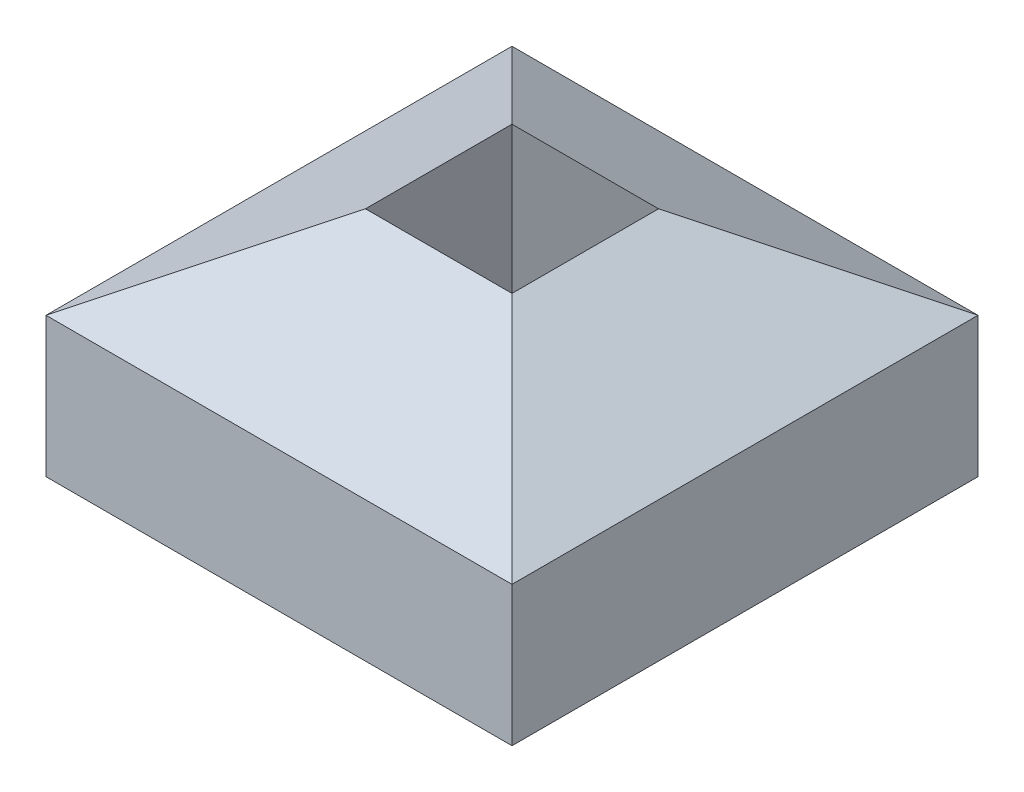
from build123d import *

# Parameters (mm, degrees)
SKETCH1_W           = 2540
SKETCH1_H           = 2540
BOSS_EXTRUDE1_DEPTH = 762
SKETCH2_W           = 762
SKETCH2_H           = 762
BOSS_EXTRUDE2_DEPTH = 508
SKETCH4_W           = 2540
SKETCH4_H           = 2540
BOSS_EXTRUDE3_DEPTH = 508
BOSS_EXTRUDE3_TAPER = 60
SKETCH5_W           = 1524
SKETCH5_H           = 1524
CUT_EXTRUDE1_DEPTH  = 1270
CUT_EXTRUDE1_DRAFT  = -16


with BuildPart() as part:
    # Sketch1 → Boss-Extrude1 (new body)
    with BuildSketch(Plane(origin=(0, 0, 0), x_dir=(1, 0, 0), z_dir=(0, 1, 0))):
        Rectangle(SKETCH1_W, SKETCH1_H)
    extrude(amount=BOSS_EXTRUDE1_DEPTH)

    # Sketch2 → Boss-Extrude2 (add)
    with BuildSketch(Plane(origin=(0, 762, 0), x_dir=(1, 0, 0), z_dir=(0, 1, 0))):
        Rectangle(SKETCH2_W, SKETCH2_H)
    extrude(amount=BOSS_EXTRUDE2_DEPTH)

    # Sketch4 → Boss-Extrude3 (add)
    with BuildSketch(Plane(origin=(0, 762, 0), x_dir=(1, 0, 0), z_dir=(0, 1, 0))):
        Rectangle(SKETCH4_W, SKETCH4_H)
    extrude(amount=BOSS_EXTRUDE3_DEPTH, taper=BOSS_EXTRUDE3_TAPER)


with BuildPart() as cut_extrude1_tool:
    # Sketch5 → Cut-Extrude1 (with draft: the straight prism first)
    with BuildSketch(Plane.XZ):
        Rectangle(SKETCH5_W, SKETCH5_H)
    extrude(amount=-CUT_EXTRUDE1_DEPTH)
    # Cut-Extrude1: the draft: its side faces are tilted about the plane it starts from
    cut_extrude1_sides = [cut_extrude1_tool.faces().sort_by_distance(p)[0] for p in [
        (762, 635, 0),
        (0, 635, 762),
        (-762, 635, 0),
        (0, 635, -762),
    ]]
    draft(cut_extrude1_sides, Plane.XZ, CUT_EXTRUDE1_DRAFT)


with BuildPart() as part_1:
    add(part.part)

    # Cut-Extrude1: cut by cut_extrude1_tool
    add(cut_extrude1_tool.part, mode=Mode.SUBTRACT)


solid = part_1.part
